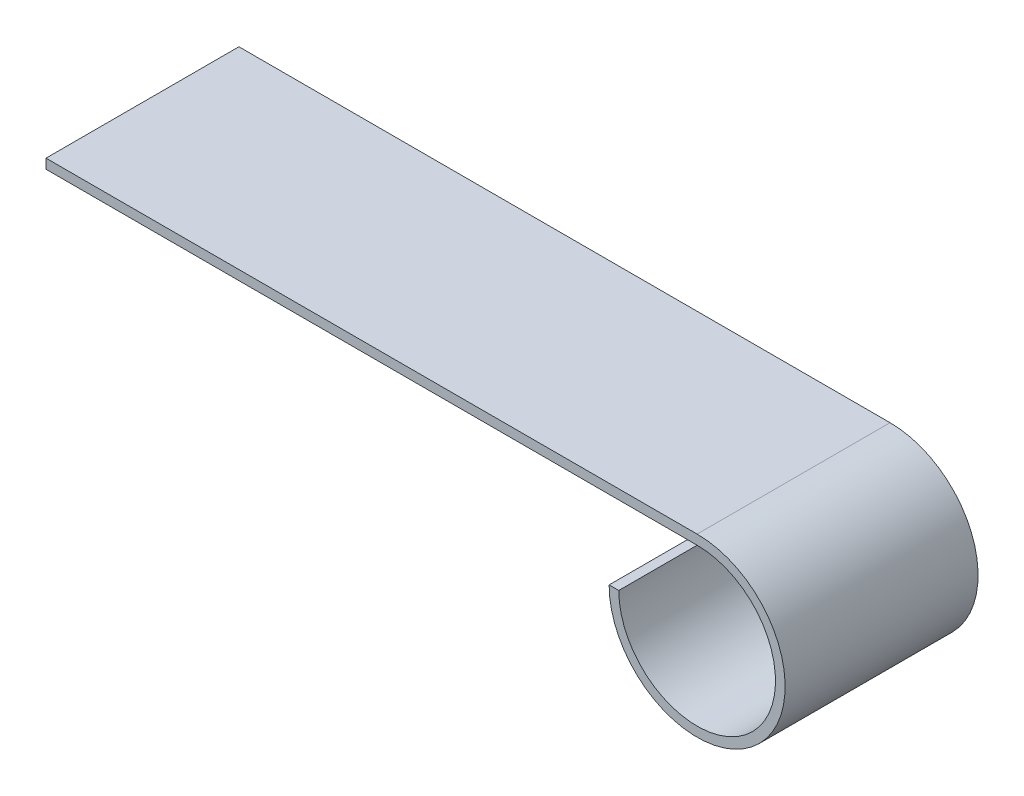
from build123d import *

# Parameters (mm, degrees)
RESSALTO_EXTRUS_O1_DEPTH = 4


with BuildPart() as part:
    # Esboço1 → Ressalto-extrusão1 (new body)
    with BuildSketch(Plane.XY):
        with BuildLine():
            Line((20.408082875, 0.8), (33.077498183, 0.8))
            Line((33.077498183, 0.8), (33.908082875, 0.8))
            ThreePointArc((33.908082875, 0.8), (35.05690323, -1.973497683), (32.283405548, -0.824677327))
            Line((32.283405548, -0.824677327), (32.083405548, -0.824677327))
            ThreePointArc((32.083405548, -0.824677327), (35.198324587, -2.114919039), (33.908082875, 1))
            Line((33.908082875, 1), (20.408082875, 1))
            Line((20.408082875, 1), (20.408082875, 0.8))
        make_face()
    extrude(amount=RESSALTO_EXTRUS_O1_DEPTH)


solid = part.part
